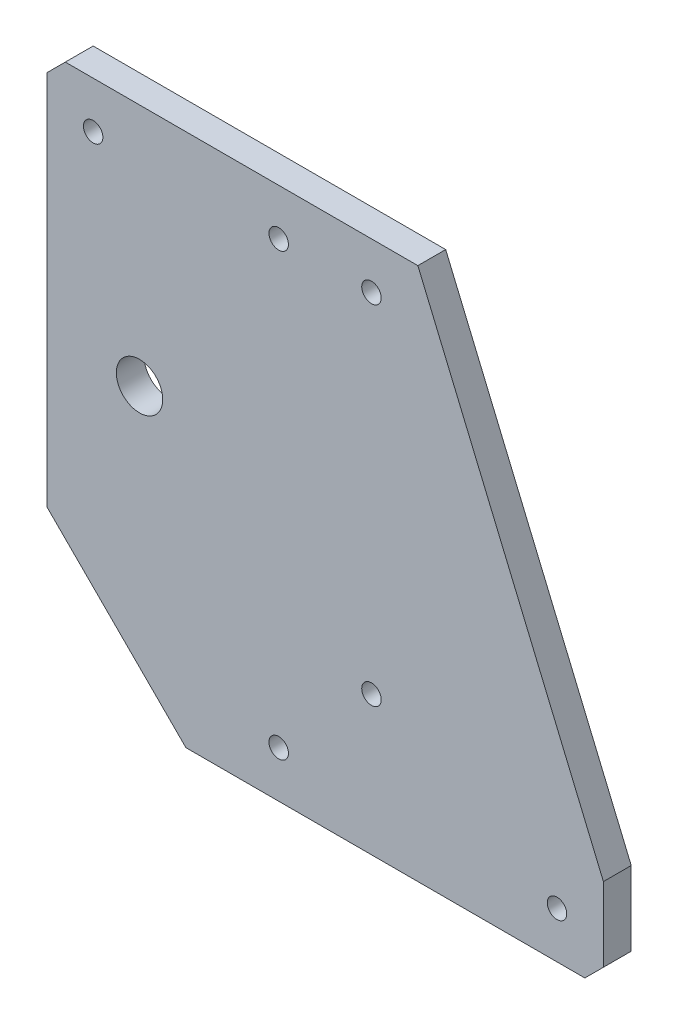
from build123d import *

# Parameters (mm, degrees)
SKETCH_1_R          = 5
EXTRUDE_1_DEPTH     = 3
SKETCH_2_R          = 2.1
CUT_EXTRUDE_1_DEPTH = 119.077305186
CHAMFER_1_SIZE      = 30
CHAMFER_3_SIZE      = 4
CHAMFER_2_SIZE      = 2


with BuildPart() as part:
    # 草图1 → 凸台-拉伸1 (new, symmetric)
    with BuildSketch(Plane.XY):
        Polygon((-20, 52.5), (-20, -62.5), (100, -62.5), (100, -42.5), (60, 52.5), align=None)
        Circle(SKETCH_1_R, mode=Mode.SUBTRACT)
    extrude(amount=EXTRUDE_1_DEPTH, both=True)

    # 草图2 → 切除-拉伸1 (cut, through all)
    with BuildSketch(Plane.XY.offset(3)):
        with Locations((-10, 42.5)):
            Circle(SKETCH_2_R)
        with Locations((30, 42.5)):
            Circle(SKETCH_2_R)
        with Locations((50, 42.5)):
            Circle(SKETCH_2_R)
        with Locations((50, -32.5)):
            Circle(SKETCH_2_R)
        with Locations((30, -52.5)):
            Circle(SKETCH_2_R)
        with Locations((90, -52.5)):
            Circle(SKETCH_2_R)
    extrude(amount=-CUT_EXTRUDE_1_DEPTH, mode=Mode.SUBTRACT)

    # 倒角1
    chamfer_1_edges = [part.edges().sort_by_distance(p)[0] for p in [
        (-20, -62.5, 0),
    ]]
    chamfer(chamfer_1_edges, length=CHAMFER_1_SIZE)

    # 倒角3
    chamfer_3_edges = [part.edges().sort_by_distance(p)[0] for p in [
        (100, -62.5, 0),
        (-20, 52.5, 0),
    ]]
    chamfer(chamfer_3_edges, length=CHAMFER_3_SIZE)

    # 倒角2
    chamfer_2_edges = [part.edges().sort_by_distance(p)[0] for p in [
        (47.9, 42.5, -3),
        (47.9, -32.5, -3),
        (27.9, -52.5, -3),
        (87.9, -52.5, -3),
    ]]
    chamfer(chamfer_2_edges, length=CHAMFER_2_SIZE)


solid = part.part
